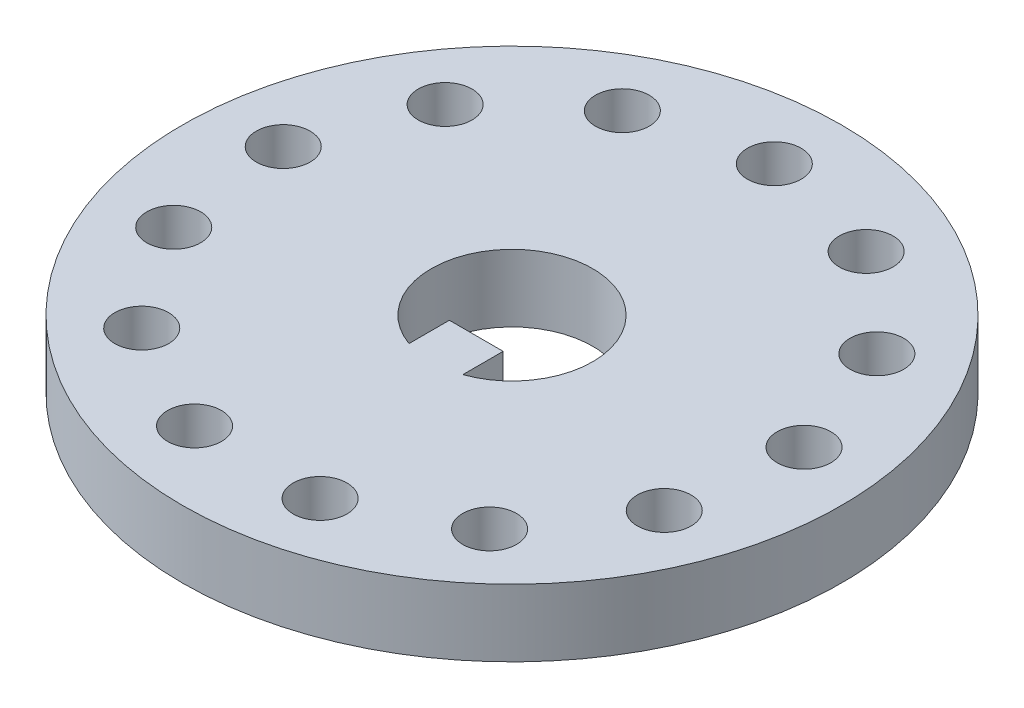
from build123d import *

# Parameters (mm, degrees)
SKETCH1_R           = 24.5
SKETCH1_R_2         = 2
BOSS_EXTRUDE1_DEPTH = 5


with BuildPart() as part:
    # Sketch1 → Boss-Extrude1 (new body)
    with BuildSketch(Plane(origin=(0, 0, 0), x_dir=(1, 0, 0), z_dir=(0, 1, 0))):
        with Locations(Location((0, 0, 0), (0, 0, 270))):
            Circle(SKETCH1_R)
        with Locations(Location((0, 19.5, 0), (0, 0, 270))):
            Circle(SKETCH1_R_2, mode=Mode.SUBTRACT)
        with Locations(Location((9.062101855, 17.2663925, 0), (0, 0, 270))):
            Circle(SKETCH1_R_2, mode=Mode.SUBTRACT)
        with Locations(Location((16.048185385, 11.077262561, 0), (0, 0, 270))):
            Circle(SKETCH1_R_2, mode=Mode.SUBTRACT)
        with Locations(Location((19.357823045, 2.350465265, 0), (0, 0, 270))):
            Circle(SKETCH1_R_2, mode=Mode.SUBTRACT)
        with Locations(Location((18.232816732, -6.914795297, 0), (0, 0, 270))):
            Circle(SKETCH1_R_2, mode=Mode.SUBTRACT)
        with Locations(Location((12.930891836, -14.595959589, 0), (0, 0, 270))):
            Circle(SKETCH1_R_2, mode=Mode.SUBTRACT)
        with Locations(Location((4.666655454, -18.93336544, 0), (0, 0, 270))):
            Circle(SKETCH1_R_2, mode=Mode.SUBTRACT)
        with Locations(Location((-4.666655454, -18.93336544, 0), (0, 0, 270))):
            Circle(SKETCH1_R_2, mode=Mode.SUBTRACT)
        with Locations(Location((-12.930891836, -14.595959589, 0), (0, 0, 270))):
            Circle(SKETCH1_R_2, mode=Mode.SUBTRACT)
        with Locations(Location((-18.232816732, -6.914795297, 0), (0, 0, 270))):
            Circle(SKETCH1_R_2, mode=Mode.SUBTRACT)
        with Locations(Location((-19.357823045, 2.350465265, 0), (0, 0, 270))):
            Circle(SKETCH1_R_2, mode=Mode.SUBTRACT)
        with Locations(Location((-16.048185385, 11.077262561, 0), (0, 0, 270))):
            Circle(SKETCH1_R_2, mode=Mode.SUBTRACT)
        with Locations(Location((-9.062101855, 17.2663925, 0), (0, 0, 270))):
            Circle(SKETCH1_R_2, mode=Mode.SUBTRACT)
        with BuildLine():
            Line((2, -5.656854249), (2, -2.656854249))
            Line((2, -2.656854249), (-2, -2.656854249))
            Line((-2, -2.656854249), (-2, -5.656854249))
            ThreePointArc((-2, -5.656854249), (0, 6), (2, -5.656854249))
        make_face(mode=Mode.SUBTRACT)
    extrude(amount=BOSS_EXTRUDE1_DEPTH)


solid = part.part
